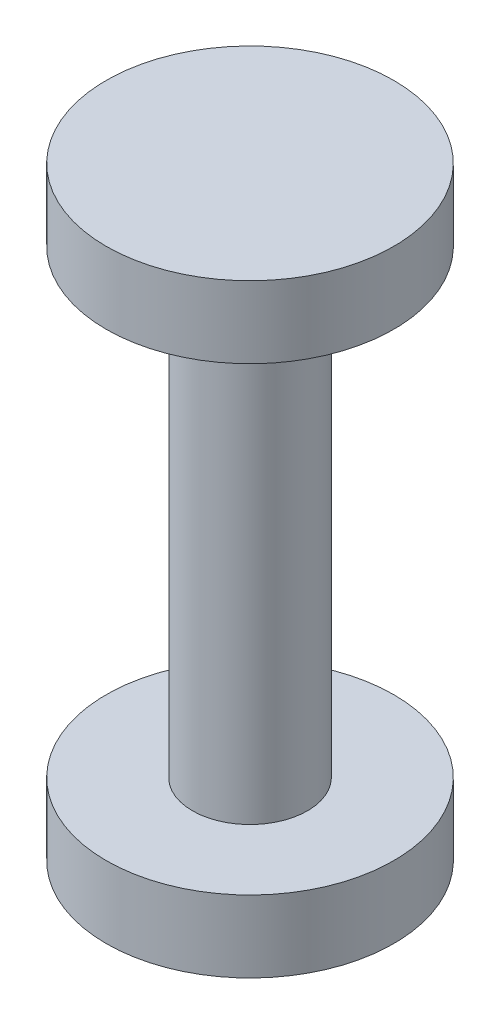
from build123d import *


with BuildPart() as part:
    # Sketch1 → Revolve1 (revolve)
    with BuildSketch(Plane.XY, mode=Mode.PRIVATE) as revolve1_sk:
        Polygon((0, 10.668), (0, 0), (2.54, 0), (2.54, 1.27), (1.016, 1.27), (1.016, 9.398), (2.54, 9.398), (2.54, 10.668), align=None)
    revolve(revolve1_sk.sketch.rotate(Axis((0, 10.668, 0), (0, -1, 0)), 90), axis=Axis((0, 10.668, 0), (0, -1, 0)))


solid = part.part
